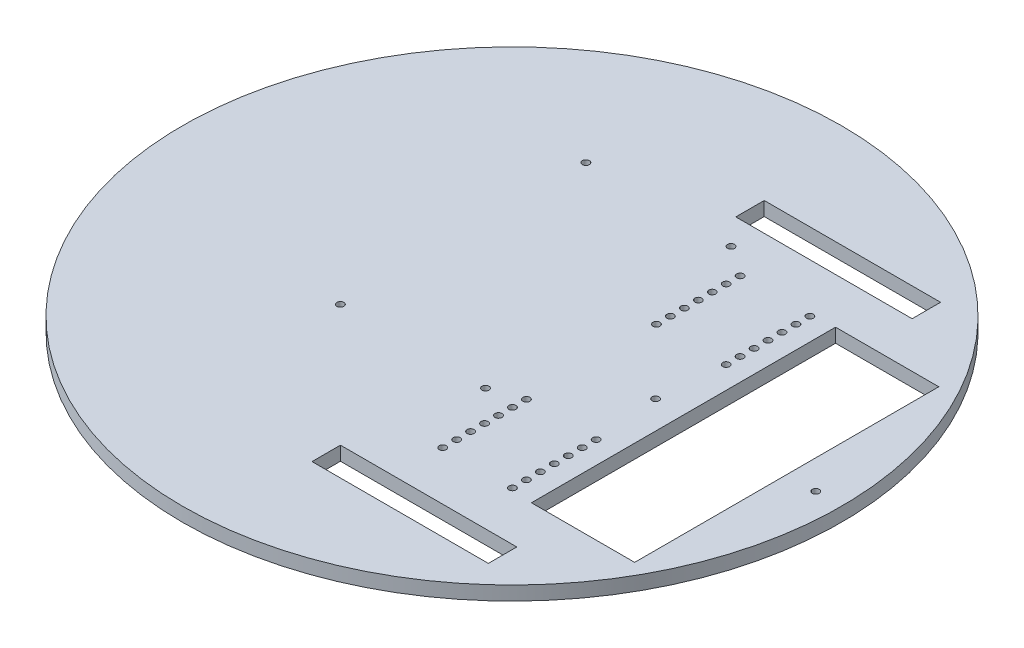
from build123d import *

# Parameters (mm, degrees)
SKETCH1_R           = 150
BOSS_EXTRUDE1_DEPTH = 6.35
SKETCH2_R           = 1.5875
SKETCH2_W           = 80.264
SKETCH2_H           = 12.954
CUT_EXTRUDE1_DEPTH  = 213.227054119
SKETCH3_R           = 1.5875
CUT_EXTRUDE2_DEPTH  = 213.227054119
SKETCH4_R           = 1.5875
SKETCH4_W           = 46.99
SKETCH4_H           = 138.43
CUT_EXTRUDE3_DEPTH  = 213.227054119


with BuildPart() as part:
    # Sketch1 → Boss-Extrude1 (new body)
    with BuildSketch(Plane(origin=(0, 0, 0), x_dir=(1, 0, 0), z_dir=(0, 1, 0))):
        with Locations(Location((0, 0, 0), (0, 0, 270))):
            Circle(SKETCH1_R)
    extrude(amount=-BOSS_EXTRUDE1_DEPTH)

    # Sketch2 → Cut-Extrude1 (cut, through all)
    with BuildSketch(Plane(origin=(0, 0, 0), x_dir=(1, 0, 0), z_dir=(0, 1, 0))):
        with Locations(Location((36.144045702, -67.691, 0), (0, 0, 270))):
            Circle(SKETCH2_R)
        with Locations(Location((36.144045702, -61.341, 0), (0, 0, 270))):
            Circle(SKETCH2_R)
        with Locations(Location((36.144045702, -54.991, 0), (0, 0, 270))):
            Circle(SKETCH2_R)
        with Locations(Location((36.144045702, -48.641, 0), (0, 0, 270))):
            Circle(SKETCH2_R)
        with Locations(Location((36.144045702, -42.291, 0), (0, 0, 270))):
            Circle(SKETCH2_R)
        with Locations(Location((36.144045702, -35.941, 0), (0, 0, 270))):
            Circle(SKETCH2_R)
        with Locations(Location((36.144045702, -29.591, 0), (0, 0, 270))):
            Circle(SKETCH2_R)
        with Locations(Location((67.894045702, -67.691, 0), (0, 0, 270))):
            Circle(SKETCH2_R)
        with Locations(Location((67.894045702, -61.341, 0), (0, 0, 270))):
            Circle(SKETCH2_R)
        with Locations(Location((67.894045702, -54.991, 0), (0, 0, 270))):
            Circle(SKETCH2_R)
        with Locations(Location((67.894045702, -48.641, 0), (0, 0, 270))):
            Circle(SKETCH2_R)
        with Locations(Location((67.894045702, -42.291, 0), (0, 0, 270))):
            Circle(SKETCH2_R)
        with Locations(Location((67.894045702, -35.941, 0), (0, 0, 270))):
            Circle(SKETCH2_R)
        with Locations(Location((67.894045702, -29.591, 0), (0, 0, 270))):
            Circle(SKETCH2_R)
        with Locations(Location((36.144045702, 67.691, 0), (0, 0, 270))):
            Circle(SKETCH2_R)
        with Locations(Location((36.144045702, 61.341, 0), (0, 0, 270))):
            Circle(SKETCH2_R)
        with Locations(Location((36.144045702, 54.991, 0), (0, 0, 270))):
            Circle(SKETCH2_R)
        with Locations(Location((36.144045702, 48.641, 0), (0, 0, 270))):
            Circle(SKETCH2_R)
        with Locations(Location((36.144045702, 42.291, 0), (0, 0, 270))):
            Circle(SKETCH2_R)
        with Locations(Location((36.144045702, 35.941, 0), (0, 0, 270))):
            Circle(SKETCH2_R)
        with Locations(Location((36.144045702, 29.591, 0), (0, 0, 270))):
            Circle(SKETCH2_R)
        with Locations(Location((67.894045702, 67.691, 0), (0, 0, 270))):
            Circle(SKETCH2_R)
        with Locations(Location((67.894045702, 61.341, 0), (0, 0, 270))):
            Circle(SKETCH2_R)
        with Locations(Location((67.894045702, 54.991, 0), (0, 0, 270))):
            Circle(SKETCH2_R)
        with Locations(Location((67.894045702, 48.641, 0), (0, 0, 270))):
            Circle(SKETCH2_R)
        with Locations(Location((67.894045702, 42.291, 0), (0, 0, 270))):
            Circle(SKETCH2_R)
        with Locations(Location((67.894045702, 35.941, 0), (0, 0, 270))):
            Circle(SKETCH2_R)
        with Locations(Location((67.894045702, 29.591, 0), (0, 0, 270))):
            Circle(SKETCH2_R)
        with Locations((52.019045702, -96.4438)):
            Rectangle(SKETCH2_W, SKETCH2_H)
        with Locations((52.019045702, 96.4438)):
            Rectangle(SKETCH2_W, SKETCH2_H)
    extrude(amount=-CUT_EXTRUDE1_DEPTH, mode=Mode.SUBTRACT)

    # Sketch3 → Cut-Extrude2 (cut, through all)
    with BuildSketch(Plane(origin=(0, 0, 0), x_dir=(1, 0, 0), z_dir=(0, 1, 0))):
        with Locations(Location((-43.611954298, 77.2668, 0), (0, 0, 270))):
            Circle(SKETCH3_R)
        with Locations(Location((22.428045702, 77.2668, 0), (0, 0, 270))):
            Circle(SKETCH3_R)
        with Locations(Location((22.428045702, -34.4932, 0), (0, 0, 270))):
            Circle(SKETCH3_R)
        with Locations(Location((-43.611954298, -34.4932, 0), (0, 0, 270))):
            Circle(SKETCH3_R)
    extrude(amount=-CUT_EXTRUDE2_DEPTH, mode=Mode.SUBTRACT)

    # Sketch4 → Cut-Extrude3 (cut, through all)
    with BuildSketch(Plane(origin=(0, 0, 0), x_dir=(1, 0, 0), z_dir=(0, 1, 0))):
        with Locations(Location((65.354045702, 0, 0), (0, 0, 270))):
            Circle(SKETCH4_R)
        with Locations(Location((138.252045702, 0, 0), (0, 0, 270))):
            Circle(SKETCH4_R)
        with Locations((101.549045702, 0)):
            Rectangle(SKETCH4_W, SKETCH4_H)
    extrude(amount=-CUT_EXTRUDE3_DEPTH, mode=Mode.SUBTRACT)


solid = part.part
